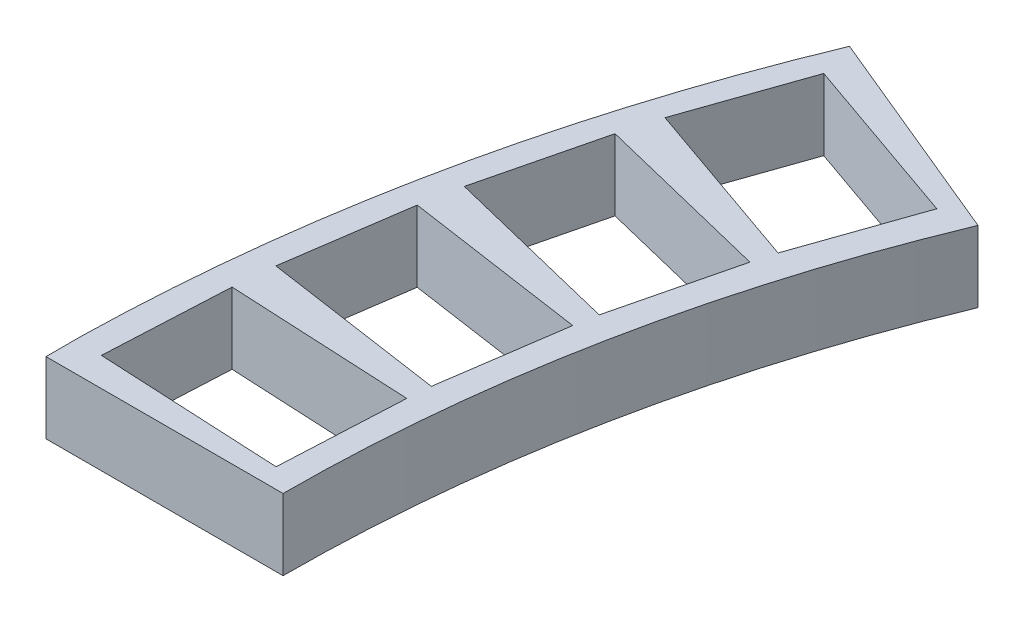
from build123d import *

# Parameters (mm, degrees)
BOSS_EXTRUDE1_DEPTH = 12


with BuildPart() as part:
    # Sketch1 → Boss-Extrude1 (new body)
    with BuildSketch(Plane(origin=(0, 0, 0), x_dir=(1, 0, 0), z_dir=(0, 1, 0))):
        with BuildLine():
            Line((-272.719864834, 112.964266743), (-235.764662876, 97.656920891))
            ThreePointArc((-235.764662876, 97.656920891), (-250.286431131, 49.785066539), (-255.189832201, 0))
            Line((-255.189832201, 0), (-295.127762341, 0))
            Line((-295.127762341, 0), (-295.127762341, 6.054265565))
            ThreePointArc((-295.127762341, 6.054265565), (-288.912043726, 60.55477872), (-272.719864834, 112.964266743))
        make_face()
        Polygon((-249.614999445, 73.084292156), (-254.615566779, 52.688353189), (-284.723857635, 60.070143062), (-279.723290301, 80.466082029), align=None, mode=Mode.SUBTRACT)
        Polygon((-241.658318908, 96.615135023), (-248.580348619, 76.788750968), (-277.847867938, 87.006985303), (-270.925838227, 106.833369358), align=None, mode=Mode.SUBTRACT)
        Polygon((-255.292380187, 48.902135943), (-258.325942442, 28.122398215), (-289.000793374, 32.600513925), (-285.967231118, 53.380251653), align=None, mode=Mode.SUBTRACT)
        Polygon((-258.638754349, 24.288905534), (-259.677683338, 3.314620647), (-290.639722934, 4.848277725), (-289.600793945, 25.822562613), align=None, mode=Mode.SUBTRACT)
    extrude(amount=BOSS_EXTRUDE1_DEPTH)


solid = part.part
